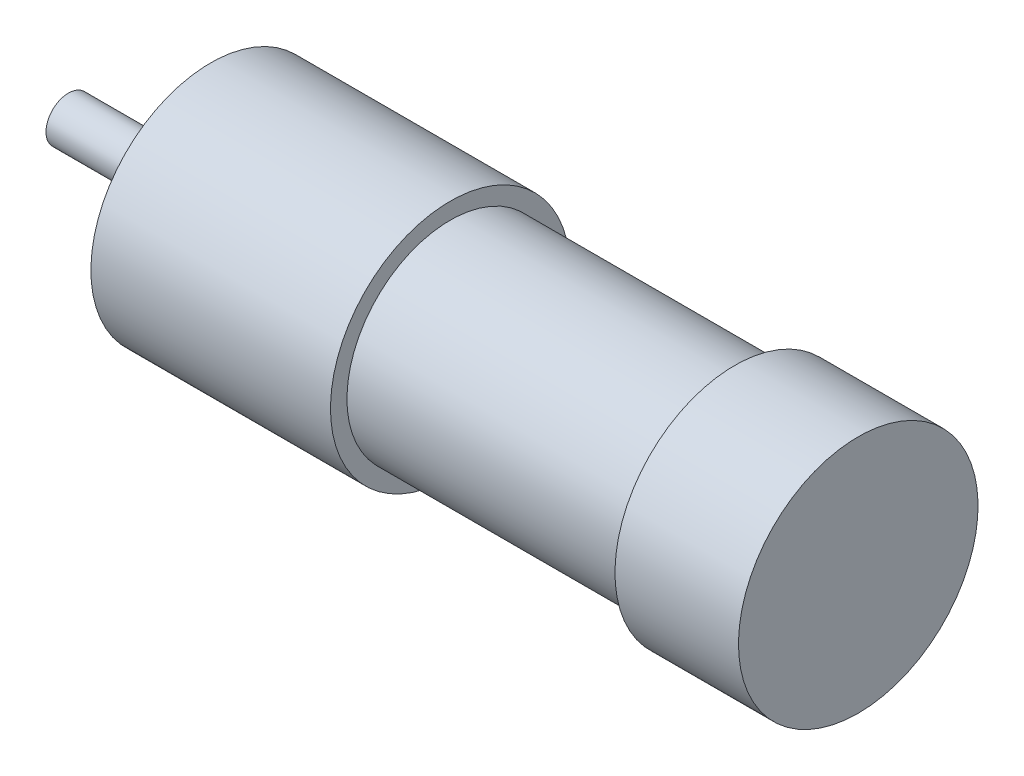
from build123d import *

# Parameters (mm, degrees)
SKETCH2_W           = 16.5
SKETCH2_H           = 16
SKETCH4_R           = 2
CUT_EXTRUDE1_DEPTH  = 8
SKETCH5_R           = 3
BOSS_EXTRUDE1_DEPTH = 16
CUT_EXTRUDE2_START  = -3
CUT_EXTRUDE2_DEPTH  = 3


with BuildPart() as part:
    # Sketch1 → Revolve1 (revolve)
    with BuildSketch(Plane.XY, mode=Mode.PRIVATE) as revolve1_sk:
        Polygon((0, 0), (0, 10), (3, 10), (3, 16), (35, 16), (35, 13.8), (73, 13.8), (73, 0), align=None)
    revolve(revolve1_sk.sketch.rotate(Axis((0, 0, 0), (1, 0, 0)), 180), axis=Axis((0, 0, 0), (1, 0, 0)))

    # Sketch2 → Revolve2 (revolve)
    with BuildSketch(Plane.XY, mode=Mode.PRIVATE) as revolve2_sk:
        with Locations((81.25, 8)):
            Rectangle(SKETCH2_W, SKETCH2_H)
    revolve(revolve2_sk.sketch.rotate(Axis((73, 0, 0), (1, 0, 0)), 180), axis=Axis((73, 0, 0), (1, 0, 0)))

    # Sketch4 → Cut-Extrude1 (cut)
    with BuildSketch(Plane.ZY.offset(-3)):
        with Locations(Location((9.192388155, 9.192388155, 0), (0, 0, 270))):
            Circle(SKETCH4_R)
        with Locations(Location((9.192388155, -9.192388155, 0), (0, 0, 270))):
            Circle(SKETCH4_R)
        with Locations(Location((-9.192388155, -9.192388155, 0), (0, 0, 270))):
            Circle(SKETCH4_R)
        with Locations(Location((-9.192388155, 9.192388155, 0), (0, 0, 270))):
            Circle(SKETCH4_R)
    extrude(amount=-CUT_EXTRUDE1_DEPTH, mode=Mode.SUBTRACT)

    # Sketch5 → Boss-Extrude1 (add)
    with BuildSketch(Plane.ZY):
        with Locations(Location((0, 0, 0), (0, 0, 270))):
            Circle(SKETCH5_R)
    extrude(amount=BOSS_EXTRUDE1_DEPTH)

    # Sketch6 → Cut-Extrude2 (cut)
    with BuildSketch(Plane.ZY.offset(CUT_EXTRUDE2_START)):
        with BuildLine():
            Line((4.358898944, -9), (-4.358898944, -9))
            ThreePointArc((-4.358898944, -9), (0, -10), (4.358898944, -9))
        make_face()
        with BuildLine():
            ThreePointArc((4.358898944, 9), (0, 10), (-4.358898944, 9))
            Line((-4.358898944, 9), (4.358898944, 9))
        make_face()
    extrude(amount=CUT_EXTRUDE2_DEPTH, mode=Mode.SUBTRACT)


solid = part.part
